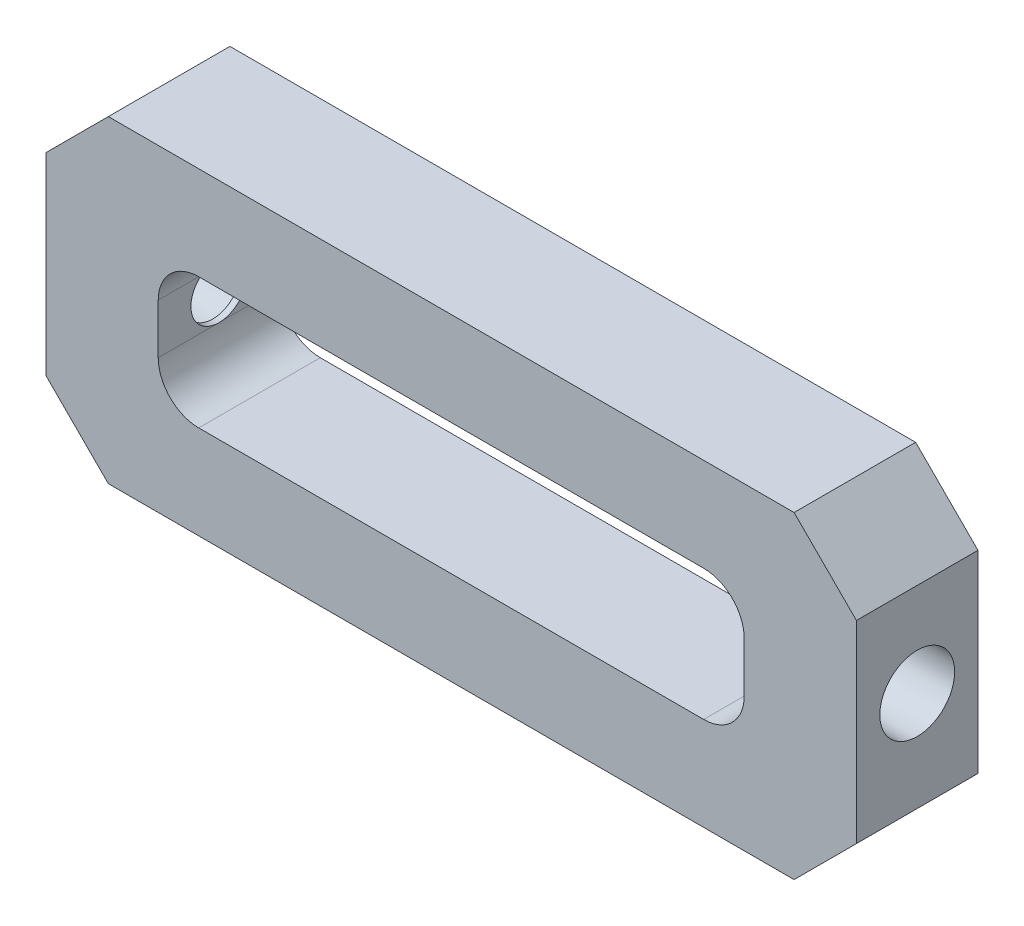
from build123d import *

# Parameters (mm, degrees)
BOSS_EXTRUDE1_DEPTH = 19.5
SKETCH2_R           = 8.5
CUT_EXTRUDE2_DEPTH  = 7
SKETCH3_R           = 4.5
CUT_EXTRUDE3_DEPTH  = 142.000886522
SKETCH5_R           = 6
CUT_EXTRUDE4_DEPTH  = 10
CUT_EXTRUDE5_START  = -10
SKETCH6_R           = 6
CUT_EXTRUDE5_DEPTH  = 10


with BuildPart() as part:
    # Model → Boss-Extrude1 (new body)
    with BuildSketch(Plane.XY):
        Polygon((0, 41), (0, 10), (10, 0), (120, 0), (130, 10), (130, 41), (120, 51), (10, 51), align=None)
        with BuildLine():
            Line((24.5, 15), (105.5, 15))
            ThreePointArc((105.5, 15), (110.096194078, 16.903805922), (112, 21.5))
            Line((112, 21.5), (112, 29.5))
            ThreePointArc((112, 29.5), (110.096194078, 34.096194078), (105.5, 36))
            Line((105.5, 36), (24.5, 36))
            ThreePointArc((24.5, 36), (19.903805922, 34.096194078), (18, 29.5))
            Line((18, 29.5), (18, 21.5))
            ThreePointArc((18, 21.5), (19.903805922, 16.903805922), (24.5, 15))
        make_face(mode=Mode.SUBTRACT)
    extrude(amount=BOSS_EXTRUDE1_DEPTH)

    # Sketch2 → Cut-Extrude2 (cut)
    with BuildSketch(Plane.ZY):
        with Locations((9.75, 26)):
            Circle(SKETCH2_R)
    extrude(amount=-CUT_EXTRUDE2_DEPTH, mode=Mode.SUBTRACT)

    # Sketch3 → Cut-Extrude3 (cut, through all)
    with BuildSketch(Plane.ZY):
        with Locations((9.75, 26)):
            Circle(SKETCH3_R)
    extrude(amount=-CUT_EXTRUDE3_DEPTH, mode=Mode.SUBTRACT)

    # Sketch5 → Cut-Extrude4 (cut)
    with BuildSketch(Plane.ZY.offset(-7)):
        with Locations((9.75, 26)):
            Circle(SKETCH5_R)
    extrude(amount=-CUT_EXTRUDE4_DEPTH, mode=Mode.SUBTRACT)

    # Sketch6 → Cut-Extrude5 (cut)
    with BuildSketch(Plane(origin=(130, 0, 0), x_dir=(0, 0, -1), z_dir=(1, 0, 0)).offset(CUT_EXTRUDE5_START)):
        with Locations(Location((-9.75, 26, 0), (0, 0, 180))):
            Circle(SKETCH6_R)
    extrude(amount=CUT_EXTRUDE5_DEPTH, mode=Mode.SUBTRACT)


solid = part.part
